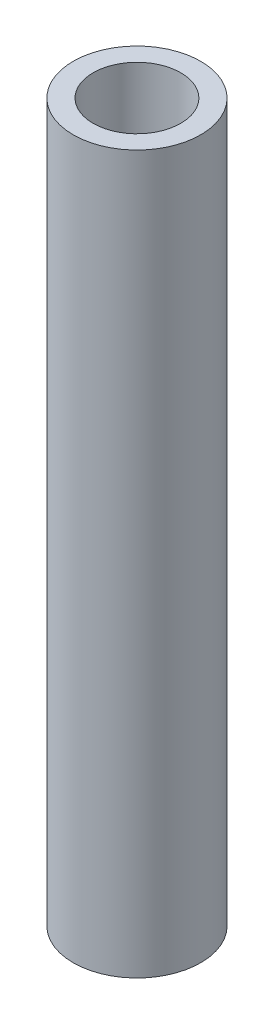
from build123d import *

# Parameters (mm, degrees)
SKETCH1_R           = 40
SKETCH1_R_2         = 27.5
BOSS_EXTRUDE1_DEPTH = 450


with BuildPart() as part:
    # Sketch1 → Boss-Extrude1 (new body)
    with BuildSketch(Plane(origin=(0, 0, 0), x_dir=(1, 0, 0), z_dir=(0, 1, 0))):
        with Locations(Location((0, 0, 0), (0, 0, 270))):
            Circle(SKETCH1_R)
        with Locations(Location((0, 0, 0), (0, 0, 270))):
            Circle(SKETCH1_R_2, mode=Mode.SUBTRACT)
    extrude(amount=BOSS_EXTRUDE1_DEPTH)


solid = part.part
